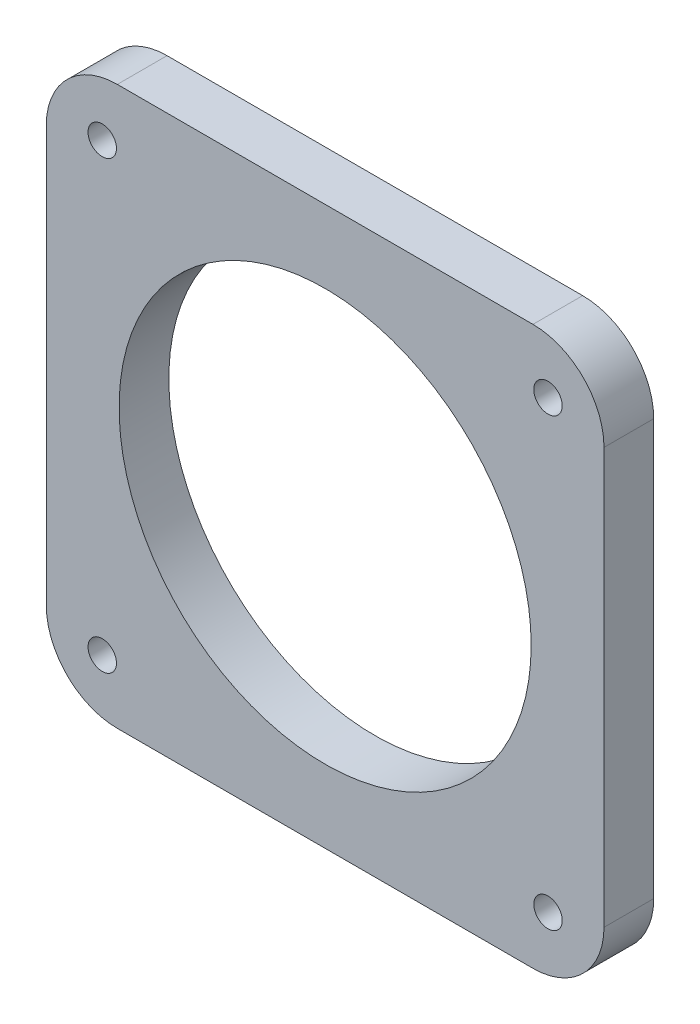
from build123d import *

# Parameters (mm, degrees)
SKETCH1_W           = 78.5
SKETCH1_H           = 78.5
BOSS_EXTRUDE1_DEPTH = 3.5
FILLET1_R           = 10
SKETCH2_R           = 2
CUT_EXTRUDE1_DEPTH  = 56.947520052
SKETCH3_R           = 29
CUT_EXTRUDE2_DEPTH  = 56.947520052


with BuildPart() as part:
    # Sketch1 → Boss-Extrude1 (new, symmetric)
    with BuildSketch(Plane.XY):
        Rectangle(SKETCH1_W, SKETCH1_H)
    extrude(amount=BOSS_EXTRUDE1_DEPTH, both=True)

    # Fillet1
    fillet1_edges = [part.edges().sort_by_distance(p)[0] for p in [
        (39.25, -39.25, 0),
        (-39.25, -39.25, 0),
        (-39.25, 39.25, 0),
        (39.25, 39.25, 0),
    ]]
    fillet(fillet1_edges, radius=FILLET1_R)

    # Sketch2 → Cut-Extrude1 (cut, through all)
    with BuildSketch(Plane.XY.offset(3.5)):
        with Locations((-31.371320344, 31.371320344)):
            Circle(SKETCH2_R)
        with Locations(Location((-31.371320344, -31.371320344, 0), (0, 0, 180))):
            Circle(SKETCH2_R)
        with Locations(Location((31.371320344, 31.371320344, 0), (0, 0, 180))):
            Circle(SKETCH2_R)
        with Locations((31.371320344, -31.371320344)):
            Circle(SKETCH2_R)
    extrude(amount=-CUT_EXTRUDE1_DEPTH, mode=Mode.SUBTRACT)

    # Sketch3 → Cut-Extrude2 (cut, through all)
    with BuildSketch(Plane.XY.offset(3.5)):
        Circle(SKETCH3_R)
    extrude(amount=-CUT_EXTRUDE2_DEPTH, mode=Mode.SUBTRACT)


solid = part.part
